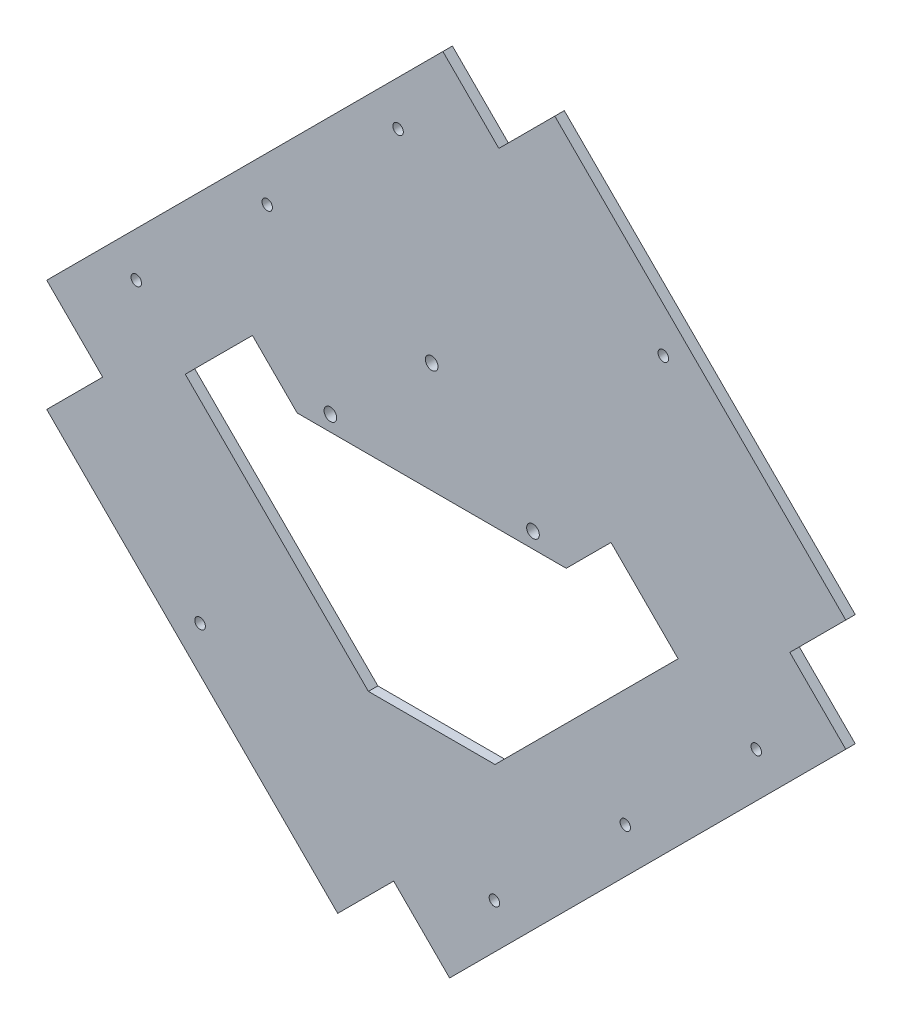
from build123d import *

# Parameters (mm, degrees)
SKETCH_1_R          = 2
EXTRUDE_1_DEPTH     = 3
CUT_EXTRUDE_2_DEPTH = 10
EXTRUDE_2_DEPTH     = 3
SKETCH_6_R          = 1.675
SKETCH_6_R_2        = 1.625
CUT_EXTRUDE_3_DEPTH = 85
SKETCH_7_R          = 1.675
SKETCH_7_R_2        = 1.625
CUT_EXTRUDE_4_DEPTH = 278.005212707
SKETCH_8_R          = 1.65
CUT_EXTRUDE_5_DEPTH = 10


with BuildPart() as part:
    # 草图1 → 凸台-拉伸1 (new body)
    with BuildSketch(Plane.XY):
        Polygon((-160.513239329, 50.913203436), (0, 211.426442765), (160.513239329, 50.913203436), (0, -109.600035894), align=None)
        with Locations((-32, 69.826406871)):
            Circle(SKETCH_1_R, mode=Mode.SUBTRACT)
        with Locations((32, 69.826406871)):
            Circle(SKETCH_1_R, mode=Mode.SUBTRACT)
        with Locations((0, 99.826406871)):
            Circle(SKETCH_1_R, mode=Mode.SUBTRACT)
        Polygon((-20, 0), (20, 0), (77.855339059, 57.855339059), (56.642135624, 79.068542495), (42.5, 64.926406871), (-42.5, 64.926406871), (-56.642135624, 79.068542495), (-77.855339059, 57.855339059), align=None, mode=Mode.SUBTRACT)
    extrude(amount=EXTRUDE_1_DEPTH)

    # 草图4 → 切除-拉伸2 (cut)
    with BuildSketch(Plane.XY.offset(3)):
        Polygon((-160.51323933, 65.226406871), (-160.513239329, 50.913203436), (0, -109.600035894), (160.513239329, 50.913203436), (160.513239329, 65.226406871), (-1e-09, -95.286832458), align=None)
    extrude(amount=-CUT_EXTRUDE_2_DEPTH, mode=Mode.SUBTRACT)

    # 草图5 → 凸台-拉伸2 (add)
    with BuildSketch(Plane.XY.offset(3)):
        Polygon((-1e-09, 225.739646201), (-160.51323933, 65.226406871), (-153.356637612, 58.069805153), (0, 211.426442765), (153.356637611, 58.069805154), (160.513239329, 65.226406871), align=None)
    extrude(amount=-EXTRUDE_2_DEPTH)

    # 草图6 → 切除-拉伸3 (cut)
    with BuildSketch(Plane.XY.offset(3)):
        with Locations((-1e-09, 211.597510577)):
            Circle(SKETCH_6_R)
        with Locations((73.185551852, 138.411958724)):
            Circle(SKETCH_6_R)
        with Locations((146.371103705, 65.226406871)):
            Circle(SKETCH_6_R)
        with Locations((73.185551852, -7.959144981)):
            Circle(SKETCH_6_R)
        with Locations((-1e-09, -81.144696834)):
            Circle(SKETCH_6_R)
        with Locations((-73.185551853, -7.959144981)):
            Circle(SKETCH_6_R)
        with Locations((-146.371103706, 65.226406871)):
            Circle(SKETCH_6_R)
        with Locations((-45.961940778, 165.6355698)):
            Circle(SKETCH_6_R_2)
    extrude(amount=-CUT_EXTRUDE_3_DEPTH, mode=Mode.SUBTRACT)

    # 草图7 → 切除-拉伸4 (cut, through all)
    # profile 1 of 7: a face of its own
    with BuildSketch(Plane(origin=(0, 0, 0), x_dir=(-1, 0, 0), z_dir=(0, 0, -1))):
        Polygon((-3.535533905, 186.848773236), (-21.213203435, 204.526442765), (-38.890872965, 186.848773236), (-21.213203435, 169.171103706), align=None)
    # profile 2 of 7: a face of its own
    with BuildSketch(Plane(origin=(0, 0, 0), x_dir=(-1, 0, 0), z_dir=(0, 0, -1))):
        Polygon((121.622366365, 26.335533906), (139.300035894, 44.013203436), (121.622366365, 61.690872966), (103.944696835, 44.013203436), align=None)
    # profile 3 of 7: a face of its own
    with BuildSketch(Plane(origin=(0, 0, 0), x_dir=(-1, 0, 0), z_dir=(0, 0, -1))):
        Polygon((160.51323933, 65.226406871), (80.256619665, 145.483026536), (59.04341623, 124.269823101), (121.622366365, 61.690872966), (139.300035894, 44.013203436), align=None)
        with Locations((146.371103706, 65.226406871)):
            Circle(SKETCH_7_R, mode=Mode.SUBTRACT)
    # profile 4 of 7: a face of its own
    with BuildSketch(Plane(origin=(0, 0, 0), x_dir=(-1, 0, 0), z_dir=(0, 0, -1))):
        Polygon((80.256619665, 145.483026536), (1e-09, 225.739646201), (-21.213203435, 204.526442765), (-3.535533905, 186.848773236), (59.04341623, 124.269823101), align=None)
        with Locations((45.961940778, 165.6355698)):
            Circle(SKETCH_7_R_2, mode=Mode.SUBTRACT)
        with Locations((1e-09, 211.597510577)):
            Circle(SKETCH_7_R, mode=Mode.SUBTRACT)
    # profile 5 of 7: a face of its own
    with BuildSketch(Plane(origin=(0, 0, 0), x_dir=(-1, 0, 0), z_dir=(0, 0, -1))):
        Polygon((-113.137084989, 77.247222152), (-130.814754519, 94.924891681), (-148.492424049, 77.247222152), (-130.814754519, 59.569552622), align=None)
    # profile 6 of 7: a face of its own
    with BuildSketch(Plane(origin=(0, 0, 0), x_dir=(-1, 0, 0), z_dir=(0, 0, -1))):
        Polygon((-5.656854249, -65.588347648), (-68.235804384, -3.009397513), (-130.814754519, 59.569552622), (-148.492424049, 77.247222152), (-160.513239329, 65.226406871), (1e-09, -95.286832458), (12.020815281, -83.266017178), align=None)
        with Locations((-73.185551852, -7.959144981)):
            Circle(SKETCH_7_R, mode=Mode.SUBTRACT)
        with Locations((1e-09, -81.144696834)):
            Circle(SKETCH_7_R, mode=Mode.SUBTRACT)
        with Locations((-146.371103705, 65.226406871)):
            Circle(SKETCH_7_R, mode=Mode.SUBTRACT)
    # profile 7 of 7: a face of its own
    with BuildSketch(Plane(origin=(0, 0, 0), x_dir=(-1, 0, 0), z_dir=(0, 0, -1))):
        Polygon((12.020815281, -47.910678118), (-5.656854249, -65.588347648), (12.020815281, -83.266017178), (29.69848481, -65.588347648), align=None)
    extrude(amount=-CUT_EXTRUDE_4_DEPTH, mode=Mode.SUBTRACT)

    # 草图8 → 切除-拉伸5 (cut)
    with BuildSketch(Plane(origin=(0, 0, 0), x_dir=(-1, 0, 0), z_dir=(0, 0, -1))):
        with Locations((10.606601718, 158.564501988)):
            Circle(SKETCH_8_R)
        with Locations((51.972348418, 117.198755289)):
            Circle(SKETCH_8_R)
        with Locations((93.338095117, 75.833008589)):
            Circle(SKETCH_8_R)
        with Locations((-102.530483271, 45.427416998)):
            Circle(SKETCH_8_R)
        with Locations((-61.164736572, 4.061670299)):
            Circle(SKETCH_8_R)
        with Locations((-19.798989873, -37.304076401)):
            Circle(SKETCH_8_R)
    extrude(amount=-CUT_EXTRUDE_5_DEPTH, mode=Mode.SUBTRACT)


solid = part.part
